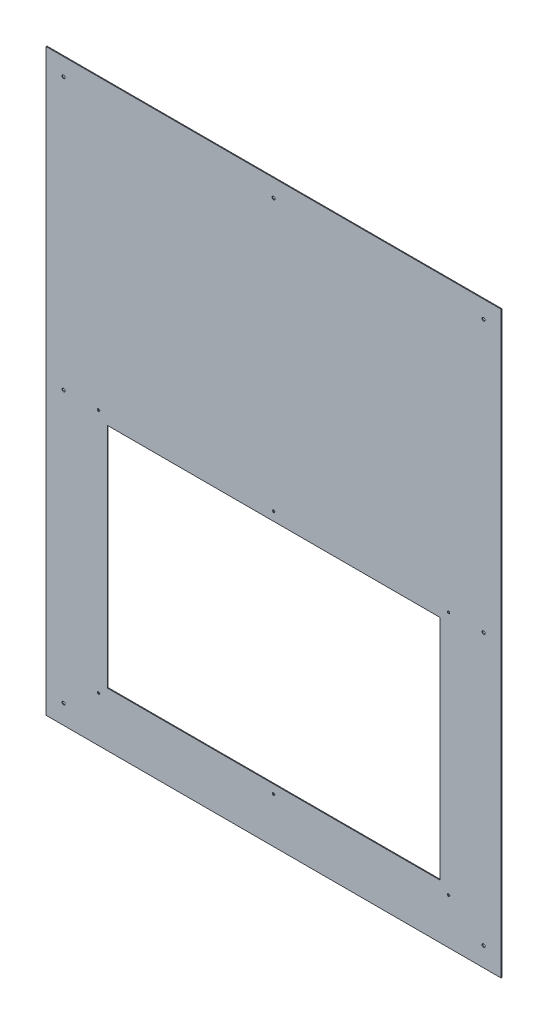
from build123d import *

# Parameters (mm, degrees)
SKETCH1_W                     = 660.4
SKETCH1_H                     = 840.74
BOSS_EXTRUDE1_DEPTH           = 1.2192
F_8_CLEARANCE_HOLE1_D         = 4.4958
SKETCH5_W                     = 482.6
SKETCH5_H                     = 330.2
CUT_EXTRUDE1_DEPTH            = 2.54
TAP_DRILL_FOR_8_32_TAP1_D     = 3.4544
TAP_DRILL_FOR_8_32_TAP1_DEPTH = 25.4
TAP_DRILL_FOR_8_32_TAP1_TIP   = 1.037806461


with BuildPart() as part:
    # Sketch1 → Boss-Extrude1 (new body)
    with BuildSketch(Plane.XY):
        with Locations((330.2, 420.37)):
            Rectangle(SKETCH1_W, SKETCH1_H)
    extrude(amount=BOSS_EXTRUDE1_DEPTH)

    # #8 Clearance Hole1 (through all)
    with Locations(Plane.XY.offset(1.2192)):
        with Locations((25.4, 815.34), (330.2, 815.34), (635, 815.34), (25.4, 421.64), (25.4, 27.94), (635, 27.94), (635, 421.64)):
            Hole(F_8_CLEARANCE_HOLE1_D / 2)

    # Sketch5 → Cut-Extrude1 (cut)
    with BuildSketch(Plane.XY.offset(1.2192)):
        with Locations((330.2, 243.84)):
            Rectangle(SKETCH5_W, SKETCH5_H)
    extrude(amount=-CUT_EXTRUDE1_DEPTH, mode=Mode.SUBTRACT)

    # Tap Drill for #8-32 Tap1
    with Locations(Plane.XY.offset(1.2192)):
        with Locations((76.2, 421.64), (330.2, 421.64), (584.2, 421.64), (584.2, 66.04), (330.2, 66.04), (76.2, 66.04)):
            Hole(TAP_DRILL_FOR_8_32_TAP1_D / 2, depth=TAP_DRILL_FOR_8_32_TAP1_DEPTH)
            with Locations((0, 0, -(TAP_DRILL_FOR_8_32_TAP1_DEPTH + TAP_DRILL_FOR_8_32_TAP1_TIP / 2))):  # 118° drill point
                Cone(0, TAP_DRILL_FOR_8_32_TAP1_D / 2, TAP_DRILL_FOR_8_32_TAP1_TIP, mode=Mode.SUBTRACT)


solid = part.part
